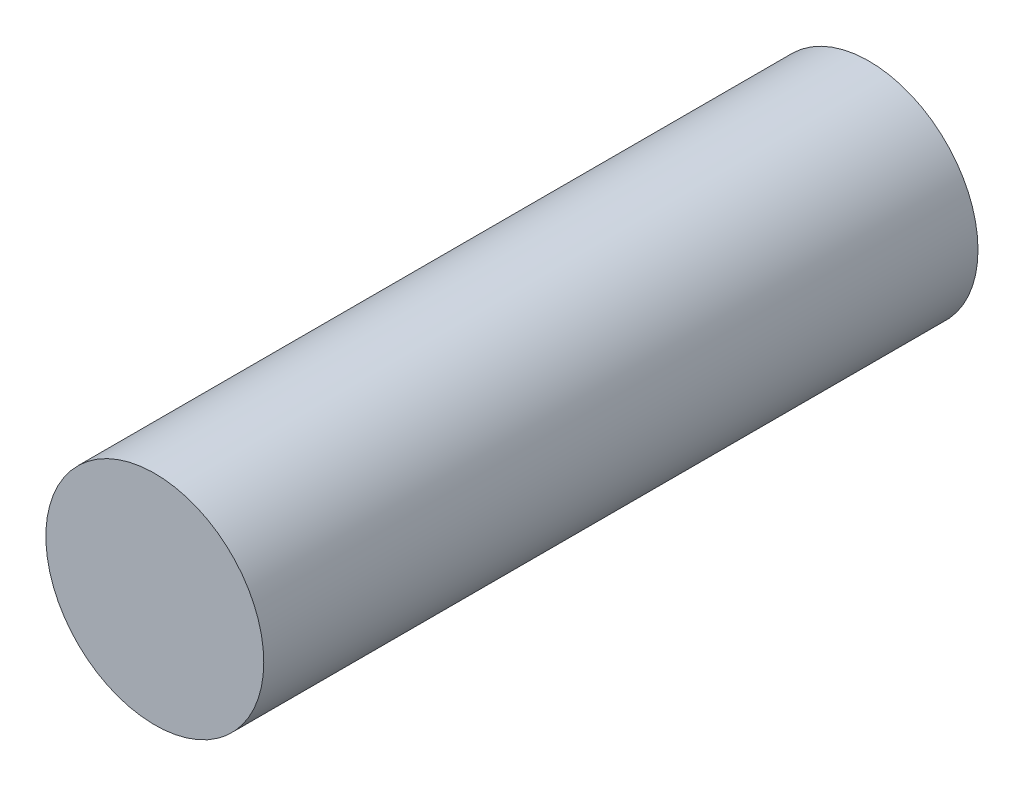
from build123d import *

# Parameters (mm, degrees)
SKETCH1_R           = 50.8
BOSS_EXTRUDE1_DEPTH = 333


with BuildPart() as part:
    # Sketch1 → Boss-Extrude1 (new body)
    with BuildSketch(Plane.XY):
        Circle(SKETCH1_R)
    extrude(amount=BOSS_EXTRUDE1_DEPTH)


solid = part.part
